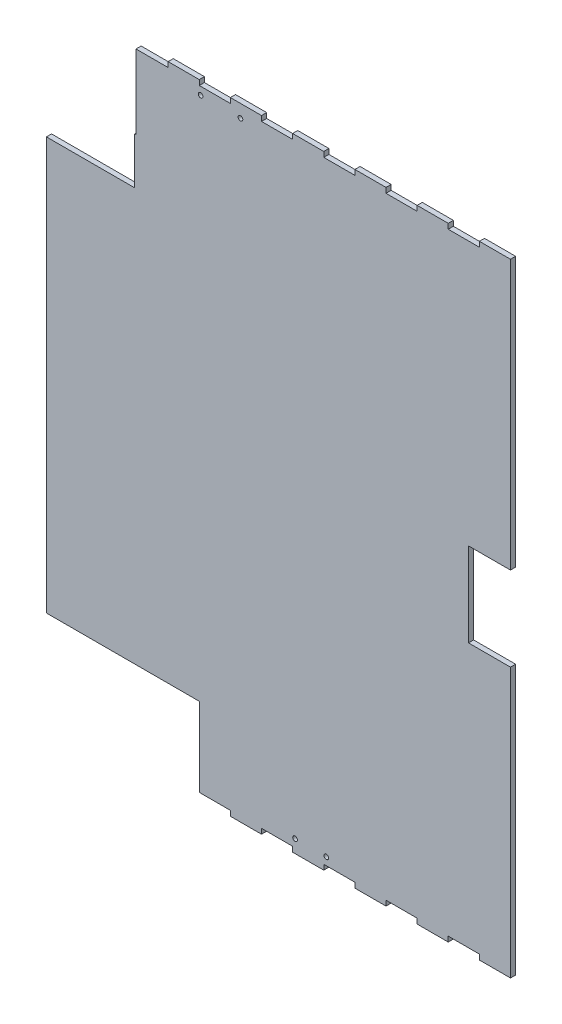
from build123d import *

# Parameters (mm, degrees)
SKETCH1_W               = 200
SKETCH1_H               = 50.7
SKETCH1_W_2             = 240.661854396
SKETCH1_H_2             = 47.7
BOSS_EXTRUDE1_DEPTH     = 3.3
SKETCH2_R               = 1.5
CUT_EXTRUDE1_DEPTH      = 453.205952877
CUT_EXTRUDE2_DEPTH      = 455.953272433
CUT_EXTRUDE2_DEPTH_BACK = 455.953272433
SKETCH3_W               = 24.5
SKETCH3_H               = 54
SKETCH4_W               = 26.984189883
SKETCH4_H               = 54
CUT_EXTRUDE3_DEPTH      = 10
SKETCH6_W               = 56.727923661
SKETCH6_H               = 30
CUT_EXTRUDE4_DEPTH      = 10
SKETCH7_W               = 20
SKETCH7_H               = 3.3
BOSS_EXTRUDE2_DEPTH     = 3.3


with BuildPart() as part:
    # Sketch1 → Boss-Extrude1 (new body)
    with BuildSketch(Plane.XY):
        Polygon((25.5, 1), (25.5, -13), (25.5, -225), (25.5, -265), (65.632913627, -265), (123.748117859, -265), (323.748117859, -265), (323.748117859, 30), (83.086263463, 30), (25.5, 30), align=None)
        with Locations((223.748117859, -290.35)):
            Rectangle(SKETCH1_W, SKETCH1_H)
        with Locations((203.417190661, 53.85)):
            Rectangle(SKETCH1_W_2, SKETCH1_H_2)
    extrude(amount=BOSS_EXTRUDE1_DEPTH)

    # Sketch2 → Cut-Extrude1 (cut, through all)
    with BuildSketch(Plane(origin=(0, 0, 0), x_dir=(-1, 0, 0), z_dir=(0, 0, -1))):
        with Locations((-150.216261358, 72.7)):
            Circle(SKETCH2_R)
        with Locations((-124.61492379, 72.7)):
            Circle(SKETCH2_R)
        with Locations((-205.394208158, -310.7)):
            Circle(SKETCH2_R)
        with Locations((-185.309760184, -310.7)):
            Circle(SKETCH2_R)
    extrude(amount=-CUT_EXTRUDE1_DEPTH, mode=Mode.SUBTRACT)

    # Sketch3 → Cut-Extrude2 (cut, two sides: drawn at the far end of the back side and taken through both)
    with BuildSketch(Plane(origin=(119.391473557, 0, 256.035841294), x_dir=(0.9063077870366519, 0, -0.42261826174069517), z_dir=(0.42261826174069517, 0, 0.9063077870366519)).offset(-CUT_EXTRUDE2_DEPTH_BACK)):
        with Locations((281.209458836, -119)):
            Rectangle(SKETCH3_W, SKETCH3_H)
    extrude(amount=CUT_EXTRUDE2_DEPTH + CUT_EXTRUDE2_DEPTH_BACK, mode=Mode.SUBTRACT)

    # Sketch4 → Cut-Extrude3 (cut)
    with BuildSketch(Plane(origin=(0, 0, 0), x_dir=(-1, 0, 0), z_dir=(0, 0, -1))):
        with Locations((-310.256022917, -119)):
            Rectangle(SKETCH4_W, SKETCH4_H)
    extrude(amount=-CUT_EXTRUDE3_DEPTH, mode=Mode.SUBTRACT)

    # Sketch6 → Cut-Extrude4 (cut)
    with BuildSketch(Plane.XY.offset(3.3)):
        with Locations((53.863961831, 15)):
            Rectangle(SKETCH6_W, SKETCH6_H)
    extrude(amount=-CUT_EXTRUDE4_DEPTH, mode=Mode.SUBTRACT)

    # Sketch7 → Boss-Extrude2 (add)
    with BuildSketch(Plane(origin=(0, 0, 0), x_dir=(-1, 0, 0), z_dir=(0, 0, -1))):
        with Locations((-193.748117858, -317.35)):
            Rectangle(SKETCH7_W, SKETCH7_H)
        with Locations((-153.748117858, -317.35)):
            Rectangle(SKETCH7_W, SKETCH7_H)
        with Locations((-113.748117859, 79.35)):
            Rectangle(SKETCH7_W, SKETCH7_H)
        with Locations((-153.748117859, 79.35)):
            Rectangle(SKETCH7_W, SKETCH7_H)
        with Locations((-233.748117858, -317.35)):
            Rectangle(SKETCH7_W, SKETCH7_H)
        with Locations((-193.748117859, 79.35)):
            Rectangle(SKETCH7_W, SKETCH7_H)
        with Locations((-273.748117858, -317.35)):
            Rectangle(SKETCH7_W, SKETCH7_H)
        with Locations((-233.748117859, 79.35)):
            Rectangle(SKETCH7_W, SKETCH7_H)
        with Locations((-313.748117858, -317.35)):
            Rectangle(SKETCH7_W, SKETCH7_H)
        with Locations((-273.748117859, 79.35)):
            Rectangle(SKETCH7_W, SKETCH7_H)
        with Locations((-313.748117859, 79.35)):
            Rectangle(SKETCH7_W, SKETCH7_H)
    extrude(amount=-BOSS_EXTRUDE2_DEPTH)


solid = part.part
